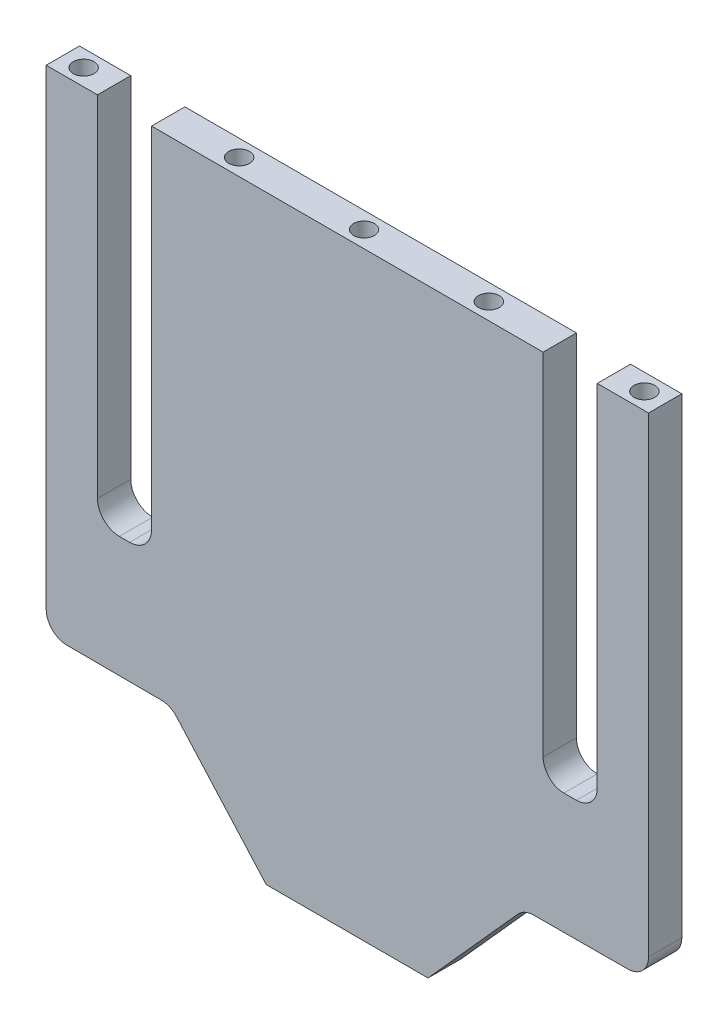
from build123d import *

# Parameters (mm, degrees)
BOSS_EXTRUDE1_DEPTH    = 8
SPLIT1_SURFACE_1_BACK  = 343.199
SPLIT1_SURFACE_1_DEPTH = 686.398
SPLIT1_SURFACE_2_BACK  = 343.199
SPLIT1_SURFACE_2_DEPTH = 686.398
SKETCH5_R              = 2.5
CUT_EXTRUDE6_DEPTH     = 10
SKETCH4_R              = 2.5
CUT_EXTRUDE7_DEPTH     = 10
SKETCH6_R              = 1.5
CUT_EXTRUDE8_DEPTH     = 342.206659287
SKETCH7_W              = 49
SKETCH7_H              = 49
SKETCH7_W_2            = 18
SKETCH7_H_2            = 18
BOSS_EXTRUDE2_DEPTH    = 15
SKETCH8_W              = 49
SKETCH8_H              = 49
SKETCH8_R              = 1.5
BOSS_EXTRUDE3_DEPTH    = 10
SKETCH9_W              = 49
SKETCH9_H              = 49
CUT_EXTRUDE9_DEPTH     = 8
SKETCH10_W             = 49
SKETCH10_H             = 49
SKETCH10_W_2           = 18
SKETCH10_H_2           = 18
BOSS_EXTRUDE4_DEPTH    = 8
SKETCH12_R             = 2.5
CUT_EXTRUDE10_DEPTH    = 343.027753759


with BuildPart() as part:
    # Sketch1 → Boss-Extrude1 (new body)
    with BuildSketch(Plane.XY):
        with BuildLine():
            Line((70, 309.985818768), (85.299227191, 309.985818768))
            ThreePointArc((85.299227191, 309.985818768), (88.489017574, 308.836174247), (90.211957942, 305.915913694))
            Line((90.211957942, 305.915913694), (96.672728921, 271.790334282))
            ThreePointArc((96.672728921, 271.790334282), (97.06575438, 270.906904614), (97.621470019, 270.115641625))
            Line((97.621470019, 270.115641625), (139.950460317, 220.786053348))
            ThreePointArc((139.950460317, 220.786053348), (141.739336996, 217.746026552), (142.361429131, 214.274017901))
            Line((142.361429131, 214.274017901), (142.361429131, 30.859943174))
            ThreePointArc((142.361429131, 30.859943174), (140.896963037, 27.324409268), (137.361429131, 25.859943174))
            Line((137.361429131, 25.859943174), (114.717190871, 25.782318449))
            ThreePointArc((114.717190871, 25.782318449), (112.681998989, 25.341726514), (111.002773989, 24.110332733))
            Line((111.002773989, 24.110332733), (89.38285929, 0))
            Line((89.38285929, 0), (50.5, 0))
            Line((50.5, 0), (28.997226011, 24.110332733))
            ThreePointArc((28.997226011, 24.110332733), (27.318001011, 25.341726514), (25.282809129, 25.782318449))
            Line((25.282809129, 25.782318449), (2.638570869, 25.859943174))
            ThreePointArc((2.638570869, 25.859943174), (-0.896963037, 27.324409268), (-2.361429131, 30.859943174))
            Line((-2.361429131, 30.859943174), (-2.361429131, 214.274017901))
            ThreePointArc((-2.361429131, 214.274017901), (-1.739336996, 217.746026552), (0.049539683, 220.786053348))
            Line((0.049539683, 220.786053348), (42.261389271, 270.115641625))
            ThreePointArc((42.261389271, 270.115641625), (42.81710491, 270.906904614), (43.210130369, 271.790334282))
            Line((43.210130369, 271.790334282), (49.724618218, 305.923183314))
            ThreePointArc((49.724618218, 305.923183314), (51.449026762, 308.838533573), (54.635967087, 309.985818768))
            Line((54.635967087, 309.985818768), (70, 309.985818768))
        make_face()
        with BuildLine():
            Line((15.218798766, 54.807228462), (17.702103505, 54.807228462))
            ThreePointArc((17.702103505, 54.807228462), (21.420312934, 56.347361236), (22.960445707, 60.065570665))
            Line((22.960445707, 60.065570665), (22.960445707, 189.807228462))
            ThreePointArc((22.960445707, 189.807228462), (21.495979613, 193.342762368), (17.960445707, 194.807228462))
            Line((17.960445707, 194.807228462), (14.960456564, 194.807228462))
            ThreePointArc((14.960456564, 194.807228462), (11.424922658, 193.342762368), (9.960456564, 189.807228462))
            Line((9.960456564, 189.807228462), (9.960456564, 60.065570665))
            ThreePointArc((9.960456564, 60.065570665), (11.500589337, 56.347361236), (15.218798766, 54.807228462))
        make_face(mode=Mode.SUBTRACT)
        with BuildLine():
            Line((125.039543436, 54.807228462), (122.039554293, 54.807228462))
            ThreePointArc((122.039554293, 54.807228462), (118.504020387, 56.271694556), (117.039554293, 59.807228462))
            Line((117.039554293, 59.807228462), (117.039554293, 189.807228462))
            ThreePointArc((117.039554293, 189.807228462), (118.504020387, 193.342762368), (122.039554293, 194.807228462))
            Line((122.039554293, 194.807228462), (125.039543436, 194.807228462))
            ThreePointArc((125.039543436, 194.807228462), (128.575077342, 193.342762368), (130.039543436, 189.807228462))
            Line((130.039543436, 189.807228462), (130.039543436, 59.807228462))
            ThreePointArc((130.039543436, 59.807228462), (128.575077342, 56.271694556), (125.039543436, 54.807228462))
        make_face(mode=Mode.SUBTRACT)
    extrude(amount=BOSS_EXTRUDE1_DEPTH)


with BuildPart() as body_2:
    # Split1: the piece behind the surface
    add(part.part)
    # Split1 surface: a surface, the sketch's curves swept straight by 686.398 mm
    with BuildLine(Plane(origin=(0, 0, 0), x_dir=(-1, 0, 0), z_dir=(0, 0, -1)).offset(-SPLIT1_SURFACE_1_BACK), mode=Mode.PRIVATE) as split1_surface_1_path:
        Line((-142.361429131, 144.05225917), (2.361429131, 144.05225917))
    split1_surface_1 = Shell.extrude(split1_surface_1_path.wire(), (0 * SPLIT1_SURFACE_1_DEPTH, 0 * SPLIT1_SURFACE_1_DEPTH, -1 * SPLIT1_SURFACE_1_DEPTH))
    split(bisect_by=split1_surface_1, keep=Keep.BOTTOM)

    # Sketch5 → Cut-Extrude6 (cut)
    with BuildSketch(Plane(origin=(0, 144.05225917, -115.359943174), x_dir=(1, 0, 0), z_dir=(0, -1, 0))):
        with Locations(Location((70, 119.359943174, 0), (0, 0, 270))):
            Circle(SKETCH5_R)
        with Locations(Location((100, 119.359943174, 0), (0, 0, 270))):
            Circle(SKETCH5_R)
        with Locations(Location((40, 119.359943174, 0), (0, 0, 270))):
            Circle(SKETCH5_R)
        with Locations(Location((2.638570869, 119.359943174, 0), (0, 0, 270))):
            Circle(SKETCH5_R)
        with Locations(Location((137.361429131, 119.359943174, 0), (0, 0, 270))):
            Circle(SKETCH5_R)
    extrude(amount=CUT_EXTRUDE6_DEPTH, mode=Mode.SUBTRACT)


with BuildPart() as part_1:
    add(part.part)

    # Split1: split by a surface, the side it looks to stays
    # Split1 surface: a surface, the sketch's curves swept straight by 686.398 mm
    with BuildLine(Plane(origin=(0, 0, 0), x_dir=(-1, 0, 0), z_dir=(0, 0, -1)).offset(-SPLIT1_SURFACE_2_BACK), mode=Mode.PRIVATE) as split1_surface_2_path:
        Line((-142.361429131, 144.05225917), (2.361429131, 144.05225917))
    split1_surface_2 = Shell.extrude(split1_surface_2_path.wire(), (0 * SPLIT1_SURFACE_2_DEPTH, 0 * SPLIT1_SURFACE_2_DEPTH, -1 * SPLIT1_SURFACE_2_DEPTH))
    split(bisect_by=split1_surface_2, keep=Keep.TOP)

    # Sketch4 → Cut-Extrude7 (cut)
    with BuildSketch(Plane(origin=(0, 144.05225917, 0), x_dir=(-1, 0, 0), z_dir=(0, -1, 0))):
        with Locations(Location((-70, -4, 0), (0, 0, 90))):
            Circle(SKETCH4_R)
        with Locations(Location((-40, -4, 0), (0, 0, 90))):
            Circle(SKETCH4_R)
        with Locations(Location((-100, -4, 0), (0, 0, 90))):
            Circle(SKETCH4_R)
        with Locations(Location((-137.361429131, -4, 0), (0, 0, 90))):
            Circle(SKETCH4_R)
        with Locations(Location((-3.799513716, -4, 0), (0, 0, 270))):
            Circle(SKETCH4_R)
    extrude(amount=-CUT_EXTRUDE7_DEPTH, mode=Mode.SUBTRACT)

    # Sketch6 → Cut-Extrude8 (cut, through all)
    with BuildSketch(Plane.XY.offset(8)):
        with Locations((50.000130369, 267.980334282)):
            Circle(SKETCH6_R)
        with Locations((90.000130369, 267.980334282)):
            Circle(SKETCH6_R)
        with Locations((90.000130369, 227.980334282)):
            Circle(SKETCH6_R)
        with Locations((50.000130369, 227.980334282)):
            Circle(SKETCH6_R)
    extrude(amount=-CUT_EXTRUDE8_DEPTH, mode=Mode.SUBTRACT)

    # Sketch7 → Boss-Extrude2 (add)
    with BuildSketch(Plane(origin=(0, 0, 0), x_dir=(-1, 0, 0), z_dir=(0, 0, -1))):
        with Locations((-70.000130369, 247.980334282)):
            Rectangle(SKETCH7_W, SKETCH7_H)
        with Locations((-56.000130369, 261.980334282)):
            Rectangle(SKETCH7_W_2, SKETCH7_H_2, mode=Mode.SUBTRACT)
        with Locations((-84.000130369, 261.980334282)):
            Rectangle(SKETCH7_W_2, SKETCH7_H_2, mode=Mode.SUBTRACT)
        with Locations((-84.000130369, 233.980334282)):
            Rectangle(SKETCH7_W_2, SKETCH7_H_2, mode=Mode.SUBTRACT)
        with Locations((-56.000130369, 233.980334282)):
            Rectangle(SKETCH7_W_2, SKETCH7_H_2, mode=Mode.SUBTRACT)
    extrude(amount=BOSS_EXTRUDE2_DEPTH)

    # Sketch8 → Boss-Extrude3 (add)
    with BuildSketch(Plane(origin=(0, 0, -15), x_dir=(-1, 0, 0), z_dir=(0, 0, -1))):
        with Locations((-70.000130369, 247.980334282)):
            Rectangle(SKETCH8_W, SKETCH8_H)
        with Locations(Location((-50.000130369, 267.980334282, 0), (0, 0, 180))):
            Circle(SKETCH8_R, mode=Mode.SUBTRACT)
        with Locations(Location((-90.000130369, 267.980334282, 0), (0, 0, 180))):
            Circle(SKETCH8_R, mode=Mode.SUBTRACT)
        with Locations(Location((-50.000130369, 227.980334282, 0), (0, 0, 180))):
            Circle(SKETCH8_R, mode=Mode.SUBTRACT)
        with Locations(Location((-90.000130369, 227.980334282, 0), (0, 0, 180))):
            Circle(SKETCH8_R, mode=Mode.SUBTRACT)
    extrude(amount=BOSS_EXTRUDE3_DEPTH)

    # Sketch9 → Cut-Extrude9 (cut)
    with BuildSketch(Plane.XY.offset(8)):
        with Locations((70.000130369, 247.980334282)):
            Rectangle(SKETCH9_W, SKETCH9_H)
    extrude(amount=-CUT_EXTRUDE9_DEPTH, mode=Mode.SUBTRACT)


with BuildPart() as cut_extrude9_piece_1:
    # of the separate pieces the step leaves, piece 1, a body of its own (cut_extrude9_pieces)
    add(part_1.part.solids().sort_by_distance((49.724618218, 305.923183314, 0))[0])



with BuildPart() as cut_extrude9_piece_2:
    # of the separate pieces the step leaves, piece 2, a body of its own (cut_extrude9_pieces)
    add(part_1.part.solids().sort_by_distance((45.500130369, 223.480334282, -25))[0])


with BuildPart() as cut_extrude9_piece_1_1:
    add(cut_extrude9_piece_1.part)

    add(cut_extrude9_piece_2.part)  # Boss-Extrude4 merges Cut-Extrude9 piece 2
    # Sketch10 → Boss-Extrude4 (add)
    with BuildSketch(Plane.XY):
        with Locations((70.000130369, 247.980334282)):
            Rectangle(SKETCH10_W, SKETCH10_H)
        with Locations((84.000130369, 261.980334282)):
            Rectangle(SKETCH10_W_2, SKETCH10_H_2, mode=Mode.SUBTRACT)
        with Locations((56.000130369, 261.980334282)):
            Rectangle(SKETCH10_W_2, SKETCH10_H_2, mode=Mode.SUBTRACT)
        with Locations((56.000130369, 233.980334282)):
            Rectangle(SKETCH10_W_2, SKETCH10_H_2, mode=Mode.SUBTRACT)
        with Locations((84.000130369, 233.980334282)):
            Rectangle(SKETCH10_W_2, SKETCH10_H_2, mode=Mode.SUBTRACT)
    extrude(amount=BOSS_EXTRUDE4_DEPTH)

    # Sketch12 → Cut-Extrude10 (cut, through all)
    with BuildSketch(Plane(origin=(0, 0, 0), x_dir=(-1, 0, 0), z_dir=(0, 0, -1))):
        with Locations((-102.960445707, 197.503395095)):
            Circle(SKETCH12_R)
        with Locations((-35.960445707, 197.503395095)):
            Circle(SKETCH12_R)
        with Locations((-35.960445707, 157.503395095)):
            Circle(SKETCH12_R)
        with Locations((-102.960445707, 157.503395095)):
            Circle(SKETCH12_R)
    extrude(amount=-CUT_EXTRUDE10_DEPTH, mode=Mode.SUBTRACT)


solid = body_2.part
